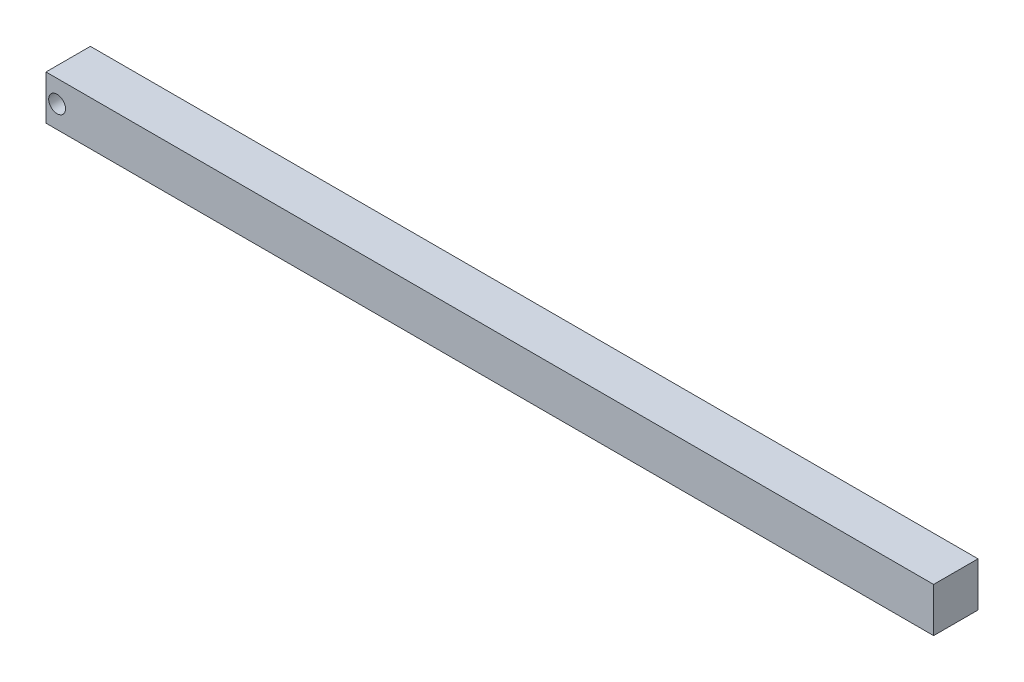
from build123d import *

# Parameters (mm, degrees)
SKETCH1_W           = 200
SKETCH1_H           = 10
BOSS_EXTRUDE1_DEPTH = 5
SKETCH2_R           = 1.9
CUT_EXTRUDE1_DEPTH  = 15


with BuildPart() as part:
    # Sketch1 → Boss-Extrude1 (new, symmetric)
    with BuildSketch(Plane.XY):
        Rectangle(SKETCH1_W, SKETCH1_H)
    extrude(amount=BOSS_EXTRUDE1_DEPTH, both=True)

    # Sketch2 → Cut-Extrude1 (cut, symmetric)
    with BuildSketch(Plane.XY):
        with Locations((-97.5, 0)):
            Circle(SKETCH2_R)
    extrude(amount=CUT_EXTRUDE1_DEPTH, both=True, mode=Mode.SUBTRACT)


solid = part.part
